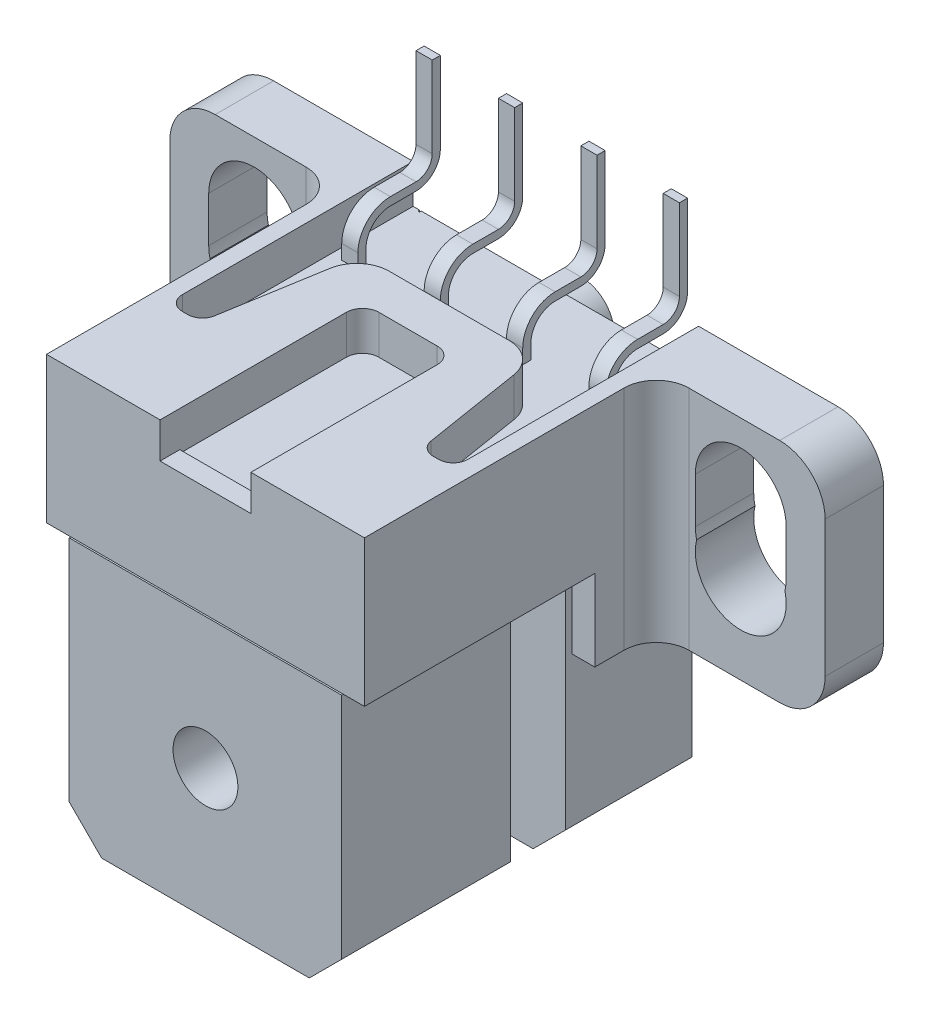
from build123d import *

# Parameters (mm, degrees)
EXTRUDE_1_DEPTH      = 10.8
SKETCH_2_R           = 1
EXTRUDE_2_DEPTH      = 0.8
SKETCH_3_W           = 1.7
SKETCH_3_H           = 8.1
CUT_EXTRUDE_1_DEPTH  = 17.8
EXTRUDE_START        = -4.5
EXTRUDE_3_DEPTH      = 4.5
SKETCH_5_W           = 8.4
SKETCH_5_H           = 0.05
CUT_EXTRUDE_2_DEPTH  = 1
SKETCH_6_R           = 1
CUT_EXTRUDE_3_DEPTH  = 8
CUT_EXTRUDE_4_DEPTH  = 1.2
SKETCH_8_W           = 2.8
SKETCH_8_H           = 0.608363533
EXTRUDE_4_DEPTH      = 0.1
EXTRUDE_START_2      = 2.5
EXTRUDE_5_DEPTH      = 2.5
SKETCH_10_W          = 8.4
SKETCH_10_H          = 1.7
CUT_EXTRUDE_5_DEPTH  = 0.05
FILLET_1_R           = 1.4
SKETCH_11_W          = 0.05
SKETCH_11_H          = 5.83834946
SKETCH_11_H_2        = 5.828769054
CUT_EXTRUDE_8_DEPTH  = 0.05
CUT_EXTRUDE_9_DEPTH  = 4
SKETCH_13_W          = 0.5
SKETCH_13_H          = 5.54
EXTRUDE_6_DEPTH      = 1.45
FILLET_2_R           = 1
CUT_EXTRUDE_START    = -8.12
CUT_EXTRUDE_10_DEPTH = 8.12
SKETCH_15_W          = 3
SKETCH_15_H          = 0.25
CUT_EXTRUDE_11_DEPTH = 8.12
SKETCH_16_W          = 0.5
SKETCH_16_H          = 0.25
EXTRUDE_7_DEPTH      = 3
FILLET_3_R           = 0.5
FILLET_4_R           = 0.75


with BuildPart() as part:
    # Эскиз1 → Бобышка-Вытянуть1 (new body)
    with BuildSketch(Plane.XY):
        Polygon((7.4, 0), (8.4, 1), (8.4, 12.6), (0, 12.6), (0, 1), (1, 0), align=None)
    extrude(amount=EXTRUDE_1_DEPTH)

    # Эскиз2 → Бобышка-Вытянуть2 (add)
    with BuildSketch(Plane(origin=(0, 0, 0), x_dir=(-1, 0, 0), z_dir=(0, 0, -1))):
        with Locations((-4.2, 10.3)):
            Circle(SKETCH_2_R)
        with Locations((-4.2, 3.9)):
            Circle(SKETCH_2_R)
    extrude(amount=EXTRUDE_2_DEPTH)

    # Эскиз3 → Вырез-Вытянуть1 (cut)
    with BuildSketch(Plane(origin=(8.4, 0, 0), x_dir=(0, 0, -1), z_dir=(1, 0, 0))):
        with Locations((-4.75, 4.05)):
            Rectangle(SKETCH_3_W, SKETCH_3_H)
    extrude(amount=-CUT_EXTRUDE_1_DEPTH, mode=Mode.SUBTRACT)

    # Эскиз4 → Бобышка-Вытянуть3 (add)
    with BuildSketch(Plane(origin=(0, 12.6, 0), x_dir=(1, 0, 0), z_dir=(0, 1, 0)).offset(EXTRUDE_START)):
        with BuildLine():
            Line((9.1, -10.8), (-0.7, -10.8))
            Line((-0.7, -10.8), (-0.7, -2.8))
            ThreePointArc((-0.7, -2.8), (-0.992893219, -2.092893219), (-1.7, -1.8))
            Line((-1.7, -1.8), (-5.9, -1.8))
            Line((-5.9, -1.8), (-5.9, 0))
            Line((-5.9, 0), (14.3, 0))
            Line((14.3, 0), (14.3, -1.8))
            Line((14.3, -1.8), (10.1, -1.8))
            ThreePointArc((10.1, -1.8), (9.392893219, -2.092893219), (9.1, -2.8))
            Line((9.1, -2.8), (9.1, -10.8))
        make_face()
    extrude(amount=EXTRUDE_3_DEPTH)

    # Эскиз5 → Вырез-Вытянуть2 (cut)
    with BuildSketch(Plane.XY.offset(10.8)):
        with Locations((4.2, 8.075)):
            Rectangle(SKETCH_5_W, SKETCH_5_H)
    extrude(amount=-CUT_EXTRUDE_2_DEPTH, mode=Mode.SUBTRACT)

    # Эскиз6 → Вырез-Вытянуть3 (cut)
    with BuildSketch(Plane.XY.offset(10.8)):
        with Locations((4.2, 4)):
            Circle(SKETCH_6_R)
    extrude(amount=-CUT_EXTRUDE_3_DEPTH, mode=Mode.SUBTRACT)

    # Эскиз7 → Вырез-Вытянуть4 (cut)
    with BuildSketch(Plane(origin=(0, 12.6, 0), x_dir=(1, 0, 0), z_dir=(0, 1, 0))):
        with BuildLine():
            Line((8.6, 0), (8.6, -7.112411136))
            ThreePointArc((8.6, -7.112411136), (8.468198052, -7.430609188), (8.15, -7.562411136))
            Line((8.15, -7.562411136), (7.983405928, -7.562411136))
            ThreePointArc((7.983405928, -7.562411136), (7.691564003, -7.454943311), (7.539115931, -7.183870205))
            Line((7.539115931, -7.183870205), (7.049736844, -4.141202068))
            ThreePointArc((7.049736844, -4.141202068), (6.710963351, -3.53881739), (6.062425739, -3.3))
            Line((6.062425739, -3.3), (2.361664993, -3.3))
            ThreePointArc((2.361664993, -3.3), (1.71573807, -3.536600753), (1.37546474, -4.13444318))
            Line((1.37546474, -4.13444318), (0.863036378, -7.186911705))
            ThreePointArc((0.863036378, -7.186911705), (0.709913379, -7.455940797), (0.419246264, -7.562411136))
            Line((0.419246264, -7.562411136), (0.25, -7.562411136))
            ThreePointArc((0.25, -7.562411136), (-0.068198052, -7.430609188), (-0.2, -7.112411136))
            Line((-0.2, -7.112411136), (-0.2, 0))
            Line((-0.2, 0), (8.6, 0))
        make_face()
        with BuildLine():
            Line((4.2, -10.8), (5.6, -10.8))
            Line((5.6, -10.8), (5.6, -5.056380156))
            ThreePointArc((5.6, -5.056380156), (5.453553391, -4.702826765), (5.1, -4.556380156))
            Line((5.1, -4.556380156), (3.3, -4.556380156))
            ThreePointArc((3.3, -4.556380156), (2.946446609, -4.702826765), (2.8, -5.056380156))
            Line((2.8, -5.056380156), (2.8, -10.8))
            Line((2.8, -10.8), (4.2, -10.8))
        make_face()
    extrude(amount=-CUT_EXTRUDE_4_DEPTH, mode=Mode.SUBTRACT)

    # Эскиз8 → Бобышка-Вытянуть4 (add)
    with BuildSketch(Plane(origin=(0, 11.4, 0), x_dir=(1, 0, 0), z_dir=(0, 1, 0))):
        with Locations((4.2, -10.495818233)):
            Rectangle(SKETCH_8_W, SKETCH_8_H)
    extrude(amount=EXTRUDE_4_DEPTH)

    # Эскиз9 → Бобышка-Вытянуть5 (add)
    with BuildSketch(Plane.XZ.offset(-8.1).offset(EXTRUDE_START_2)):
        with BuildLine():
            Line((0, 0), (0, 3.7))
            Line((0, 3.7), (-0.7, 3.7))
            Line((-0.7, 3.7), (-0.7, 2.8))
            ThreePointArc((-0.7, 2.8), (-0.992893219, 2.092893219), (-1.7, 1.8))
            Line((-1.7, 1.8), (-5.9, 1.8))
            Line((-5.9, 1.8), (-5.9, 0))
            Line((-5.9, 0), (0, 0))
        make_face()
        with BuildLine():
            Line((14.3, 0), (8.4, 0))
            Line((8.4, 0), (8.4, 3.7))
            Line((8.4, 3.7), (9.1, 3.7))
            Line((9.1, 3.7), (9.1, 2.8))
            ThreePointArc((9.1, 2.8), (9.392893219, 2.092893219), (10.1, 1.8))
            Line((10.1, 1.8), (14.3, 1.8))
            Line((14.3, 1.8), (14.3, 0))
        make_face()
    extrude(amount=-EXTRUDE_5_DEPTH)

    # Эскиз10 → Вырез-Вытянуть5 (cut)
    with BuildSketch(Plane.XZ.offset(-8.1)):
        with Locations((4.2, 4.75)):
            Rectangle(SKETCH_10_W, SKETCH_10_H)
    extrude(amount=-CUT_EXTRUDE_5_DEPTH, mode=Mode.SUBTRACT)

    # Скругление1
    fillet_1_edges = [part.edges().sort_by_distance(p)[0] for p in [
        (-5.9, 5.6, 0.9),
        (14.3, 5.6, 0.9),
        (14.3, 12.6, 0.9),
        (-5.9, 12.6, 0.9),
    ]]
    fillet(fillet_1_edges, radius=FILLET_1_R)

    # Эскиз11 → Вырез-Вытянуть8 (cut)
    with BuildSketch(Plane(origin=(0, 0, 0), x_dir=(-1, 0, 0), z_dir=(0, 0, -1))):
        with Locations((-8.375, 8.48082527)):
            Rectangle(SKETCH_11_W, SKETCH_11_H)
        with Locations((-0.025, 8.485615473)):
            Rectangle(SKETCH_11_W, SKETCH_11_H_2)
    extrude(amount=-CUT_EXTRUDE_8_DEPTH, mode=Mode.SUBTRACT)

    # Эскиз12 → Вырез-Вытянуть9 (cut)
    with BuildSketch(Plane(origin=(0, 0, 0), x_dir=(-1, 0, 0), z_dir=(0, 0, -1))):
        with BuildLine():
            Line((1.9, 9), (1.9, 10.4))
            ThreePointArc((1.9, 10.4), (3.3, 11.8), (4.7, 10.4))
            Line((4.7, 10.4), (4.7, 9))
            ThreePointArc((4.7, 9), (4.690102856, 8.833825246), (4.660551359, 8.67))
            ThreePointArc((4.660551359, 8.67), (3.3, 6.94), (1.939448641, 8.67))
            ThreePointArc((1.939448641, 8.67), (1.909897144, 8.833825246), (1.9, 9))
        make_face()
        with BuildLine():
            Line((-10.3, 10.4), (-10.3, 9))
            ThreePointArc((-10.3, 9), (-10.309897144, 8.833825246), (-10.339448641, 8.67))
            ThreePointArc((-10.339448641, 8.67), (-11.7, 6.94), (-13.060551359, 8.67))
            ThreePointArc((-13.060551359, 8.67), (-13.090102856, 8.833825246), (-13.1, 9))
            Line((-13.1, 9), (-13.1, 10.4))
            ThreePointArc((-13.1, 10.4), (-11.7, 11.8), (-10.3, 10.4))
        make_face()
    extrude(amount=-CUT_EXTRUDE_9_DEPTH, mode=Mode.SUBTRACT)

    # Эскиз13 → Бобышка-Вытянуть6 (add)
    with BuildSketch(Plane(origin=(0, 11.4, 0), x_dir=(1, 0, 0), z_dir=(0, 1, 0))):
        with Locations((5.47, 0.23)):
            Rectangle(SKETCH_13_W, SKETCH_13_H)
        with Locations((8.01, 0.23)):
            Rectangle(SKETCH_13_W, SKETCH_13_H)
        with Locations((2.93, 0.23)):
            Rectangle(SKETCH_13_W, SKETCH_13_H)
        with Locations((0.39, 0.23)):
            Rectangle(SKETCH_13_W, SKETCH_13_H)
    extrude(amount=EXTRUDE_6_DEPTH)

    # Скругление2
    fillet_2_edges = [part.edges().sort_by_distance(p)[0] for p in [
        (5.47, 12.85, 2.54),
        (2.93, 12.85, 2.54),
        (0.39, 12.85, 2.54),
        (8.01, 12.85, 2.54),
    ]]
    fillet(fillet_2_edges, radius=FILLET_2_R)

    # Эскиз14 → Вырез-Вытянуть10 (cut)
    with BuildSketch(Plane.ZY.offset(-0.14).offset(CUT_EXTRUDE_START)):
        with BuildLine():
            Line((-3, 12.6), (1.54, 12.6))
            ThreePointArc((1.54, 12.6), (2.070330086, 12.380330086), (2.29, 11.85))
            Line((2.29, 11.85), (2.29, 11.4))
            Line((2.29, 11.4), (-3, 11.4))
            Line((-3, 11.4), (-3, 12.6))
        make_face()
    extrude(amount=CUT_EXTRUDE_10_DEPTH, mode=Mode.SUBTRACT)

    # Эскиз15 → Вырез-Вытянуть11 (cut)
    with BuildSketch(Plane(origin=(8.26, 0, 0), x_dir=(0, 0, -1), z_dir=(1, 0, 0)).offset(CUT_EXTRUDE_START)):
        with Locations((1.5, 12.725)):
            Rectangle(SKETCH_15_W, SKETCH_15_H)
    extrude(amount=CUT_EXTRUDE_11_DEPTH, mode=Mode.SUBTRACT)

    # Эскиз16 → Бобышка-Вытянуть7 (add)
    with BuildSketch(Plane(origin=(0, 12.85, 0), x_dir=(1, 0, 0), z_dir=(0, 1, 0))):
        with Locations((8.01, -0.125)):
            Rectangle(SKETCH_16_W, SKETCH_16_H)
        with Locations((5.47, -0.125)):
            Rectangle(SKETCH_16_W, SKETCH_16_H)
        with Locations((2.93, -0.125)):
            Rectangle(SKETCH_16_W, SKETCH_16_H)
        with Locations((0.39, -0.125)):
            Rectangle(SKETCH_16_W, SKETCH_16_H)
    extrude(amount=EXTRUDE_7_DEPTH)

    # Скругление3
    fillet_3_edges = [part.edges().sort_by_distance(p)[0] for p in [
        (8.01, 12.85, 0.25),
        (5.47, 12.85, 0.25),
        (2.93, 12.85, 0.25),
        (0.39, 12.85, 0.25),
    ]]
    fillet(fillet_3_edges, radius=FILLET_3_R)

    # Скругление4
    fillet_4_edges = [part.edges().sort_by_distance(p)[0] for p in [
        (5.47, 12.6, 0),
        (2.93, 12.6, 0),
        (0.39, 12.6, 0),
        (8.01, 12.6, 0),
    ]]
    fillet(fillet_4_edges, radius=FILLET_4_R)


solid = part.part
